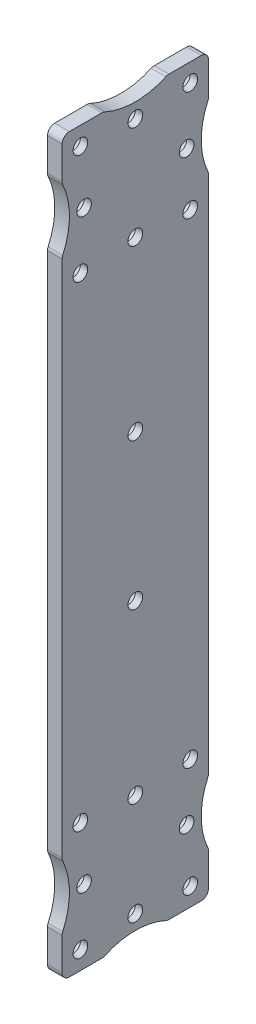
from build123d import *

# Parameters (mm, degrees)
SKETCH_1_W          = 20
SKETCH_1_H          = 100
SKETCH_1_R          = 1
EXTRUDE_1_DEPTH     = 2
SKETCH_3_R          = 10
CUT_EXTRUDE_2_DEPTH = 10
SKETCH_4_R          = 1
CUT_EXTRUDE_3_DEPTH = 10
FILLET_2_R          = 1
SKETCH_5_R          = 1
CUT_EXTRUDE_4_DEPTH = 103
SKETCH_6_R          = 1.5
CUT_EXTRUDE_5_DEPTH = 1


with BuildPart() as part:
    # 草图1 → 凸台-拉伸1 (new body)
    with BuildSketch(Plane(origin=(0, 0, 0), x_dir=(0, 0, -1), z_dir=(1, 0, 0))):
        with Locations((10, 50)):
            Rectangle(SKETCH_1_W, SKETCH_1_H)
        with Locations((2.5, 97.5)):
            Circle(SKETCH_1_R, mode=Mode.SUBTRACT)
        with Locations((17.5, 97.5)):
            Circle(SKETCH_1_R, mode=Mode.SUBTRACT)
        with Locations((17.5, 82.5)):
            Circle(SKETCH_1_R, mode=Mode.SUBTRACT)
        with Locations((2.5, 82.5)):
            Circle(SKETCH_1_R, mode=Mode.SUBTRACT)
        with Locations(Location((17.5, 17.5, 0), (0, 0, 180))):
            Circle(SKETCH_1_R, mode=Mode.SUBTRACT)
        with Locations(Location((2.5, 17.5, 0), (0, 0, 180))):
            Circle(SKETCH_1_R, mode=Mode.SUBTRACT)
        with Locations(Location((2.5, 2.5, 0), (0, 0, 180))):
            Circle(SKETCH_1_R, mode=Mode.SUBTRACT)
        with Locations(Location((17.5, 2.5, 0), (0, 0, 180))):
            Circle(SKETCH_1_R, mode=Mode.SUBTRACT)
    extrude(amount=EXTRUDE_1_DEPTH)

    # 草图3 → 切除-拉伸2 (cut)
    with BuildSketch(Plane(origin=(2, 0, 0), x_dir=(0, 0, -1), z_dir=(1, 0, 0))):
        with Locations((10, 109)):
            Circle(SKETCH_3_R)
        with Locations((-9, 90)):
            Circle(SKETCH_3_R)
        with Locations((29, 90)):
            Circle(SKETCH_3_R)
    cut_extrude_2 = extrude(amount=-CUT_EXTRUDE_2_DEPTH, mode=Mode.SUBTRACT)

    # 镜向2: 切除-拉伸2 across plane
    add(cut_extrude_2.mirror(Plane(origin=(0, 50, 0), x_dir=(0, 0, 1), z_dir=(0, -1, 0))), mode=Mode.SUBTRACT)

    # 草图4 → 切除-拉伸3 (cut)
    with BuildSketch(Plane(origin=(2, 0, 0), x_dir=(0, 0, -1), z_dir=(1, 0, 0))):
        with Locations((10, 97)):
            Circle(SKETCH_4_R)
        with Locations((3, 90)):
            Circle(SKETCH_4_R)
        with Locations((17, 90)):
            Circle(SKETCH_4_R)
        with Locations((10, 83)):
            Circle(SKETCH_4_R)
    cut_extrude_3 = extrude(amount=-CUT_EXTRUDE_3_DEPTH, mode=Mode.SUBTRACT)

    # 镜向3: 切除-拉伸3 across plane
    add(cut_extrude_3.mirror(Plane(origin=(0, 50, 0), x_dir=(0, 0, 1), z_dir=(0, -1, 0))), mode=Mode.SUBTRACT)

    # 圆角2
    fillet_2_edges = [part.edges().sort_by_distance(p)[0] for p in [
        (1, 100, -5.641101056),
        (1, 100, -14.358898944),
        (1, 85.641101056, 0),
        (1, 94.358898944, 0),
        (1, 94.358898944, -20),
        (1, 85.641101056, -20),
        (1, 100, 0),
        (1, 0, -14.358898944),
        (1, 100, -20),
        (1, 0, -5.641101056),
        (1, 0, -20),
        (1, 0, 0),
        (1, 5.641101056, 0),
        (1, 14.358898944, 0),
        (1, 14.358898944, -20),
        (1, 5.641101056, -20),
    ]]
    fillet(fillet_2_edges, radius=FILLET_2_R)

    # 草图5 → 切除-拉伸4 (cut, through all)
    with BuildSketch(Plane.ZY):
        with Locations((-10, 60)):
            Circle(SKETCH_5_R)
        with Locations((-10, 40)):
            Circle(SKETCH_5_R)
    extrude(amount=-CUT_EXTRUDE_4_DEPTH, mode=Mode.SUBTRACT)

    # 草图6 → 切除-拉伸5 (cut)
    with BuildSketch(Plane.ZY):
        with Locations((-2.5, 97.5)):
            Circle(SKETCH_6_R)
        with Locations((-3, 90)):
            Circle(SKETCH_6_R)
        with Locations((-2.5, 82.5)):
            Circle(SKETCH_6_R)
        with Locations((-10, 97)):
            Circle(SKETCH_6_R)
        with Locations((-10, 83)):
            Circle(SKETCH_6_R)
        with Locations((-17.5, 97.5)):
            Circle(SKETCH_6_R)
        with Locations((-17, 90)):
            Circle(SKETCH_6_R)
        with Locations((-17.5, 82.5)):
            Circle(SKETCH_6_R)
        with Locations((-10, 60)):
            Circle(SKETCH_6_R)
        with Locations((-10, 40)):
            Circle(SKETCH_6_R)
        with Locations((-2.5, 17.5)):
            Circle(SKETCH_6_R)
        with Locations((-3, 10)):
            Circle(SKETCH_6_R)
        with Locations((-2.5, 2.5)):
            Circle(SKETCH_6_R)
        with Locations((-10, 17)):
            Circle(SKETCH_6_R)
        with Locations((-10, 3)):
            Circle(SKETCH_6_R)
        with Locations((-17.5, 17.5)):
            Circle(SKETCH_6_R)
        with Locations((-17, 10)):
            Circle(SKETCH_6_R)
        with Locations((-17.5, 2.5)):
            Circle(SKETCH_6_R)
    extrude(amount=-CUT_EXTRUDE_5_DEPTH, mode=Mode.SUBTRACT)


solid = part.part
